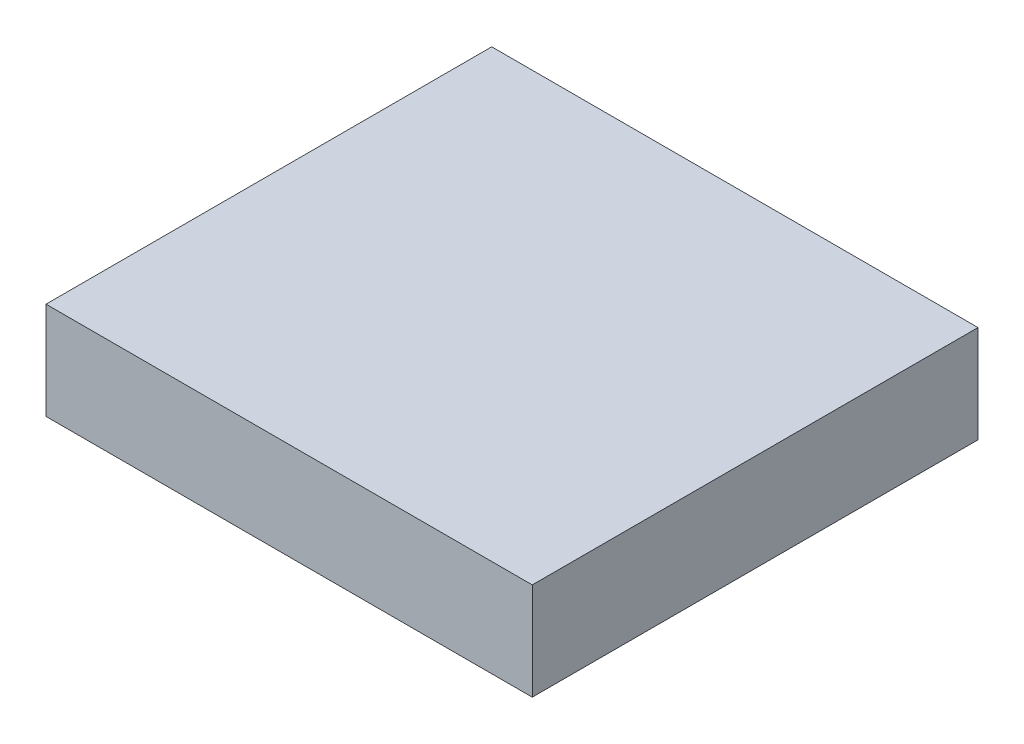
from build123d import *

# Parameters (mm, degrees)
SKETCH1_W           = 60
SKETCH1_H           = 55
BOSS_EXTRUDE1_DEPTH = 12


with BuildPart() as part:
    # Sketch1 → Boss-Extrude1 (new body)
    with BuildSketch(Plane(origin=(0, 0, 0), x_dir=(1, 0, 0), z_dir=(0, 1, 0))):
        with Locations((30, 27.5)):
            Rectangle(SKETCH1_W, SKETCH1_H)
    extrude(amount=BOSS_EXTRUDE1_DEPTH)


solid = part.part
